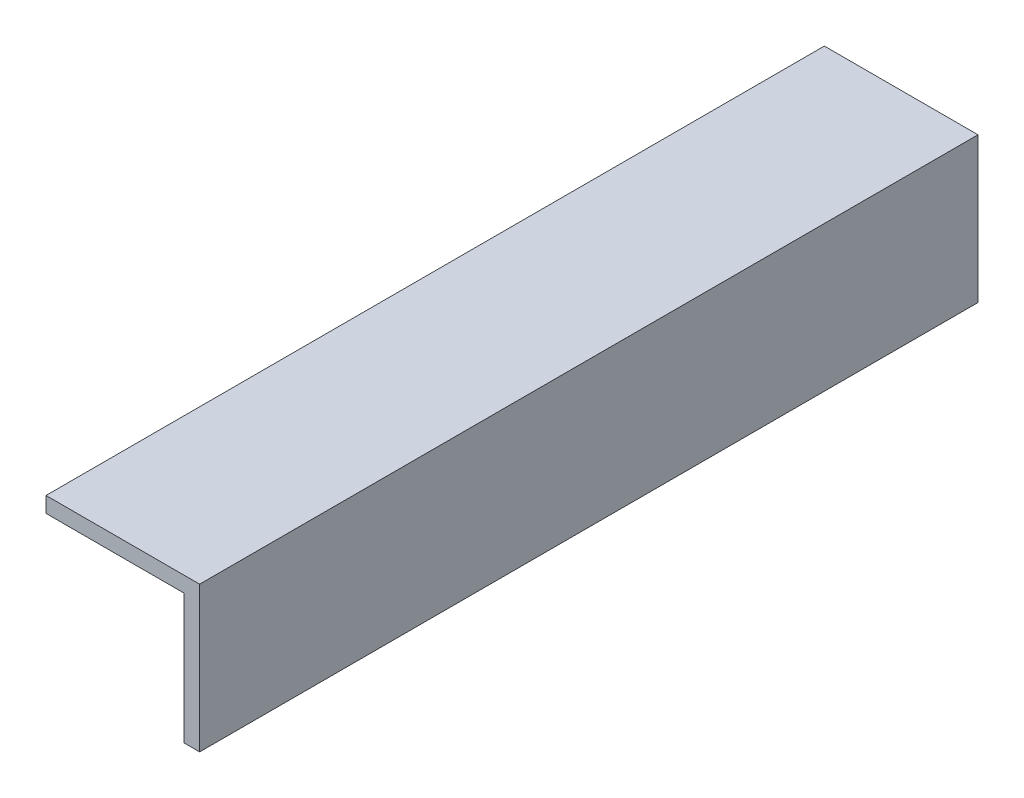
from build123d import *

# Parameters (mm, degrees)
BOSS_EXTRUDE1_DEPTH = 150


with BuildPart() as part:
    # Sketch1 → Boss-Extrude1 (new body)
    with BuildSketch(Plane.XY):
        Polygon((0, 0), (29.607237152, 0), (29.607237152, -28), (26.607237152, -28), (26.607237152, -3), (0, -3), align=None)
    extrude(amount=BOSS_EXTRUDE1_DEPTH)


solid = part.part
